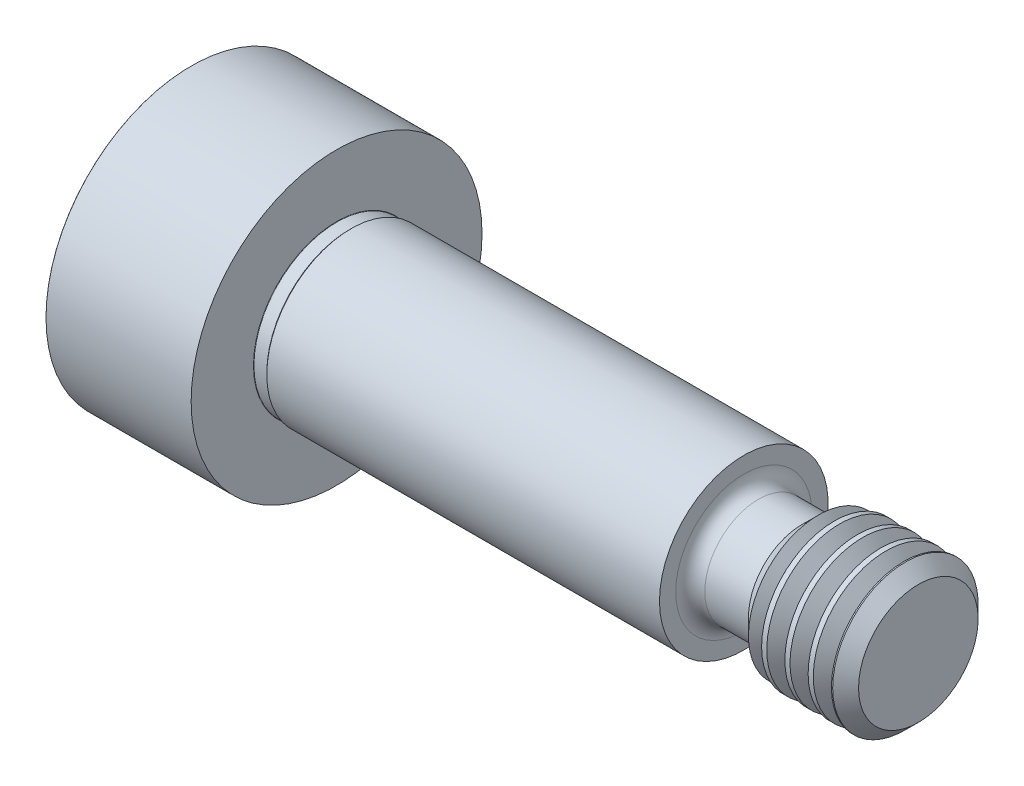
from build123d import *

# Parameters (mm, degrees)
CHAMFER1_SIZE   = 0.01
HEX_2_DEPTH     = 2.4
THDSCHPAT_COUNT = 4
THDSCHPAT_PITCH = 0.8


with BuildPart() as part:
    # BodySke → BaseBody (revolve)
    with BuildSketch(Plane.XY, mode=Mode.PRIVATE) as basebody_sk:
        with BuildLine():
            Line((0, 0), (0, 5))
            Line((0, 5), (5, 5))
            Line((5, 5), (5, 2.86))
            ThreePointArc((5, 2.86), (5.002928932, 2.852928932), (5.01, 2.85))
            Line((5.01, 2.85), (5.45, 2.85))
            Line((5.45, 2.85), (5.5, 2.9))
            Line((5.5, 2.9), (19, 2.9))
            Line((19, 2.9), (19, 2.34))
            ThreePointArc((19, 2.34), (19.146446609, 1.986446609), (19.5, 1.84))
            Line((19.5, 1.84), (21, 1.84))
            Line((21, 1.84), (21.66, 2.5))
            Line((21.66, 2.5), (24.555, 2.5))
            Line((24.555, 2.5), (25, 2.055))
            Line((25, 2.055), (25, 0))
            Line((25, 0), (0, 0))
        make_face()
    revolve(basebody_sk.sketch.rotate(Axis((-6.35, 0, 0), (1, 0, 0)), 90), axis=Axis((-6.35, 0, 0), (1, 0, 0)))

    # Chamfer1
    chamfer1_edges = [part.edges().sort_by_distance(p)[0] for p in [
        (0, 0, -5),
    ]]
    chamfer(chamfer1_edges, length=CHAMFER1_SIZE)

    # Sketch2 → PreBroach (revolve, cut)
    with BuildSketch(Plane.XY, mode=Mode.PRIVATE) as prebroach_sk:
        Polygon((0, 1.54), (2.4, 1.54), (3.289119415, 0), (0, 0), align=None)
    revolve(prebroach_sk.sketch.rotate(Axis((0, 0, 0), (1, 0, 0)), 90), axis=Axis((0, 0, 0), (1, 0, 0)), mode=Mode.SUBTRACT)

    # Sketch3 → Hex 2 (cut)
    with BuildSketch(Plane.ZY):
        Polygon((-1.54, -0.889119415), (-1.54, 0.889119415), (0, 1.778238829), (1.54, 0.889119415), (1.54, -0.889119415), (0, -1.778238829), align=None)
    extrude(amount=-HEX_2_DEPTH, mode=Mode.SUBTRACT)

    # ThdSchSke → ThreadSchematic (revolve, cut)
    with BuildSketch(Plane.XY):
        Polygon((21.8, -2.055), (21.20832463, -2.9), (21.20832463, -3.625), (22.39167537, -3.625), (22.39167537, -2.9), align=None)
    threadschematic = revolve(axis=Axis((-3.175, 0, 0), (1, 0, 0)), mode=Mode.SUBTRACT)

    # ThdSchPat: ThreadSchematic ×4
    with Locations(*[(i * THDSCHPAT_PITCH, 0, 0) for i in range(1, THDSCHPAT_COUNT)]):
        add(threadschematic, mode=Mode.SUBTRACT)


solid = part.part
